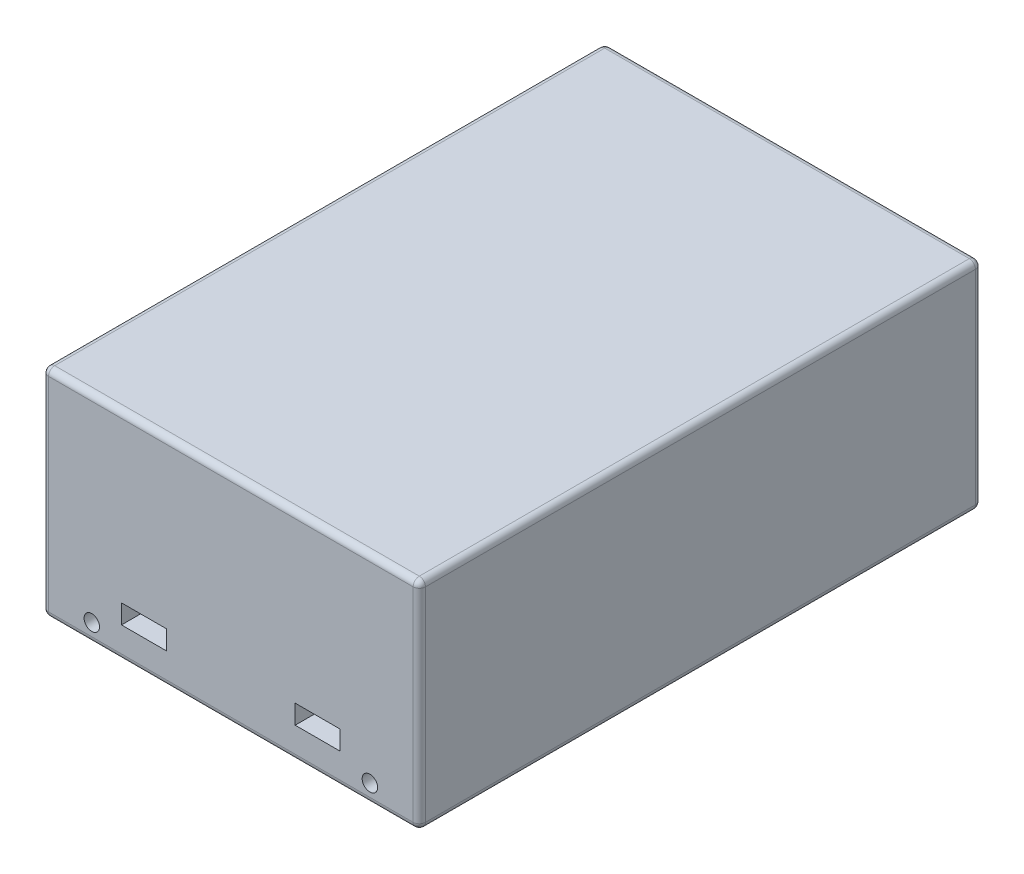
from build123d import *

# Parameters (mm, degrees)
SKETCH_1_W             = 61
SKETCH_1_H             = 91
EXTRUDE_1_DEPTH        = 35
HOLE_WIZARD_M3_1_D     = 2.5
HOLE_WIZARD_M3_1_DEPTH = 10
HOLE_WIZARD_M3_1_TIP   = 0.751075774
M3X0_5_1_D             = 2.5
M3X0_5_1_DEPTH         = 10
M3X0_5_1_TIP           = 0.751075774
HOLE_WIZARD_M3_2_D     = 2.5
HOLE_WIZARD_M3_2_DEPTH = 10
HOLE_WIZARD_M3_2_TIP   = 0.751075774
FILLET_1_R             = 1
SKETCH_9_W             = 7.285769401
SKETCH_9_H             = 3.095672023
CUT_EXTRUDE_1_DEPTH    = 10
SKETCH_10_W            = 75.598284418
SKETCH_10_H            = 3.429789841
CUT_EXTRUDE_2_DEPTH    = 10


with BuildPart() as part:
    # 草图1 → 凸台-拉伸1 (new body)
    with BuildSketch(Plane(origin=(0, 0, 0), x_dir=(1, 0, 0), z_dir=(0, 1, 0))):
        Rectangle(SKETCH_1_W, SKETCH_1_H)
    extrude(amount=EXTRUDE_1_DEPTH)

    # M3 螺纹孔1
    with Locations(Plane(origin=(-22.5, 3, 45.5), x_dir=(1, 0, 0), z_dir=(0, 0, 1))):
        with Locations((0, 0), (45, 0)):
            Hole(HOLE_WIZARD_M3_1_D / 2, depth=HOLE_WIZARD_M3_1_DEPTH)
            with Locations((0, 0, -(HOLE_WIZARD_M3_1_DEPTH + HOLE_WIZARD_M3_1_TIP / 2))):  # 118° drill point
                Cone(0, HOLE_WIZARD_M3_1_D / 2, HOLE_WIZARD_M3_1_TIP, mode=Mode.SUBTRACT)

    # M3x0.5 螺纹孔1
    with Locations(Plane(origin=(0, 0, -45.5), x_dir=(-1, 0, 0), z_dir=(0, 0, -1))):
        with Locations((-22.5, 3), (22.5, 3)):
            Hole(M3X0_5_1_D / 2, depth=M3X0_5_1_DEPTH)
            with Locations((0, 0, -(M3X0_5_1_DEPTH + M3X0_5_1_TIP / 2))):  # 118° drill point
                Cone(0, M3X0_5_1_D / 2, M3X0_5_1_TIP, mode=Mode.SUBTRACT)

    # M3 螺纹孔2
    with Locations(Plane(origin=(0, 0, 0), x_dir=(-1, 0, 0), z_dir=(0, -1, 0))):
        with Locations((14, 0), (-14, 0)):
            Hole(HOLE_WIZARD_M3_2_D / 2, depth=HOLE_WIZARD_M3_2_DEPTH)
            with Locations((0, 0, -(HOLE_WIZARD_M3_2_DEPTH + HOLE_WIZARD_M3_2_TIP / 2))):  # 118° drill point
                Cone(0, HOLE_WIZARD_M3_2_D / 2, HOLE_WIZARD_M3_2_TIP, mode=Mode.SUBTRACT)

    # 圆角1
    fillet_1_edges = [part.edges().sort_by_distance(p)[0] for p in [
        (-30.5, 35, 0),
        (0, 35, 45.5),
        (30.5, 35, 0),
        (0, 0, 45.5),
        (-30.5, 0, 0),
        (0, 0, -45.5),
        (30.5, 0, 0),
        (30.5, 17.5, 45.5),
        (-30.5, 17.5, 45.5),
        (-30.5, 17.5, -45.5),
        (30.5, 17.5, -45.5),
        (0, 35, -45.5),
    ]]
    fillet(fillet_1_edges, radius=FILLET_1_R)

    # 草图9 → 切除-拉伸1 (cut)
    with BuildSketch(Plane.XY.offset(45.5)):
        with Locations((14.053983322, 6.612378958)):
            Rectangle(SKETCH_9_W, SKETCH_9_H)
        with Locations((-14.053983322, 6.612378958)):
            Rectangle(SKETCH_9_W, SKETCH_9_H)
    extrude(amount=-CUT_EXTRUDE_1_DEPTH, mode=Mode.SUBTRACT)

    # 草图10 → 切除-拉伸2 (cut)
    with BuildSketch(Plane.ZY.offset(30.5)):
        with Locations((0, 4.995557871)):
            Rectangle(SKETCH_10_W, SKETCH_10_H)
    extrude(amount=-CUT_EXTRUDE_2_DEPTH, mode=Mode.SUBTRACT)


solid = part.part
